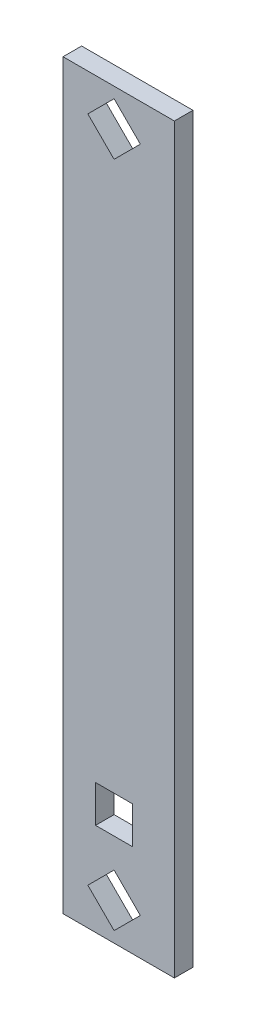
from build123d import *

# Parameters (mm, degrees)
PROFILE_SKETCH_W               = 6
PROFILE_SKETCH_H               = 1
PROFILE_EXTRUDE_DEPTH          = 40
FIDUCIAL_CUT_DEPTH             = 44.409509652
FIDUCIAL_1_INDICATOR_SKETCH_W  = 2
FIDUCIAL_1_INDICATOR_SKETCH_H  = 2
FIDUCIAL_1_INDICATOR_CUT_DEPTH = 44.409509652


with BuildPart() as part:
    # Profile Sketch → Profile Extrude (new body)
    with BuildSketch(Plane(origin=(-13.83405858, 0, -105.75669297), x_dir=(-1, 0, 0), z_dir=(0, 1, 0))):
        with Locations((0, 0.5)):
            Rectangle(PROFILE_SKETCH_W, PROFILE_SKETCH_H)
    extrude(amount=PROFILE_EXTRUDE_DEPTH)

    # Fiducial Sketch → Fiducial Cut (cut, through all)
    with BuildSketch(Plane.XY.offset(-104.75669297)):
        Polygon((-12.669845017, 2), (-14.08405858, 3.414213562), (-15.498272142, 2), (-14.08405858, 0.585786438), align=None)
    fiducial_cut = extrude(amount=-FIDUCIAL_CUT_DEPTH, mode=Mode.SUBTRACT)

    # Fiducial Mirror: Fiducial Cut across plane
    add(fiducial_cut.mirror(Plane(origin=(0, 20, 0), x_dir=(0, 0, 1), z_dir=(0, -1, 0))), mode=Mode.SUBTRACT)

    # Fiducial 1 Indicator Sketch → Fiducial 1 Indicator Cut (cut, through all)
    with BuildSketch(Plane.XY.offset(-104.75669297)):
        with Locations((-14.08405858, 6)):
            Rectangle(FIDUCIAL_1_INDICATOR_SKETCH_W, FIDUCIAL_1_INDICATOR_SKETCH_H)
    extrude(amount=-FIDUCIAL_1_INDICATOR_CUT_DEPTH, mode=Mode.SUBTRACT)


solid = part.part
